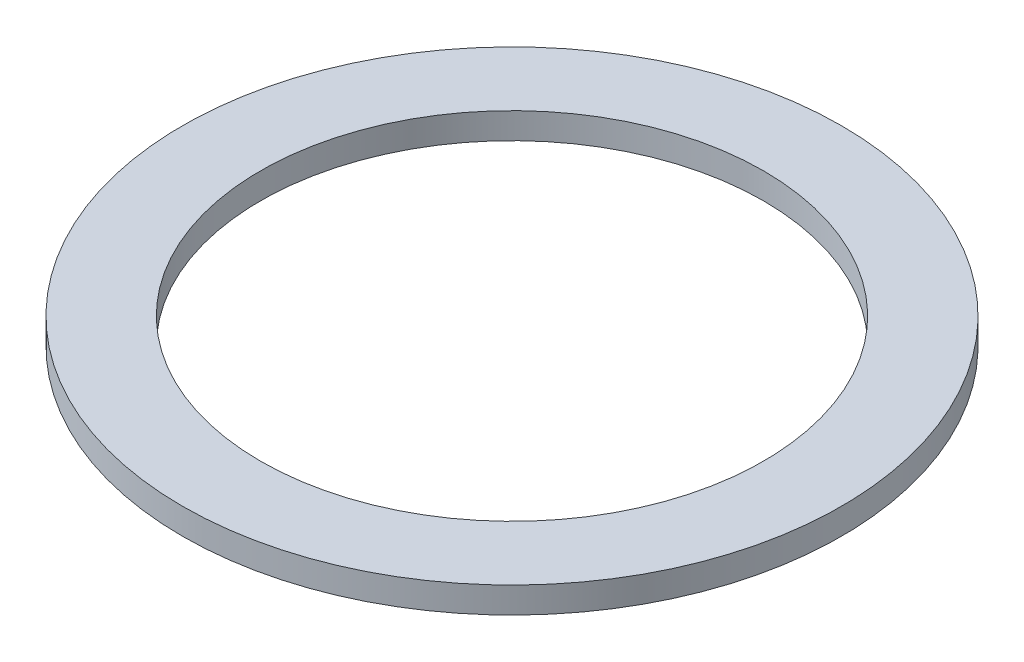
from build123d import *

# Parameters (mm, degrees)
SKETCH1_R           = 38
SKETCH1_R_2         = 29
BOSS_EXTRUDE1_DEPTH = 3


with BuildPart() as part:
    # Sketch1 → Boss-Extrude1 (new body)
    with BuildSketch(Plane(origin=(0, 0, 0), x_dir=(1, 0, 0), z_dir=(0, 1, 0))):
        with Locations(Location((0, 0, 0), (0, 0, 270))):
            Circle(SKETCH1_R)
        with Locations(Location((0, 0, 0), (0, 0, 270))):
            Circle(SKETCH1_R_2, mode=Mode.SUBTRACT)
    extrude(amount=BOSS_EXTRUDE1_DEPTH)


solid = part.part
